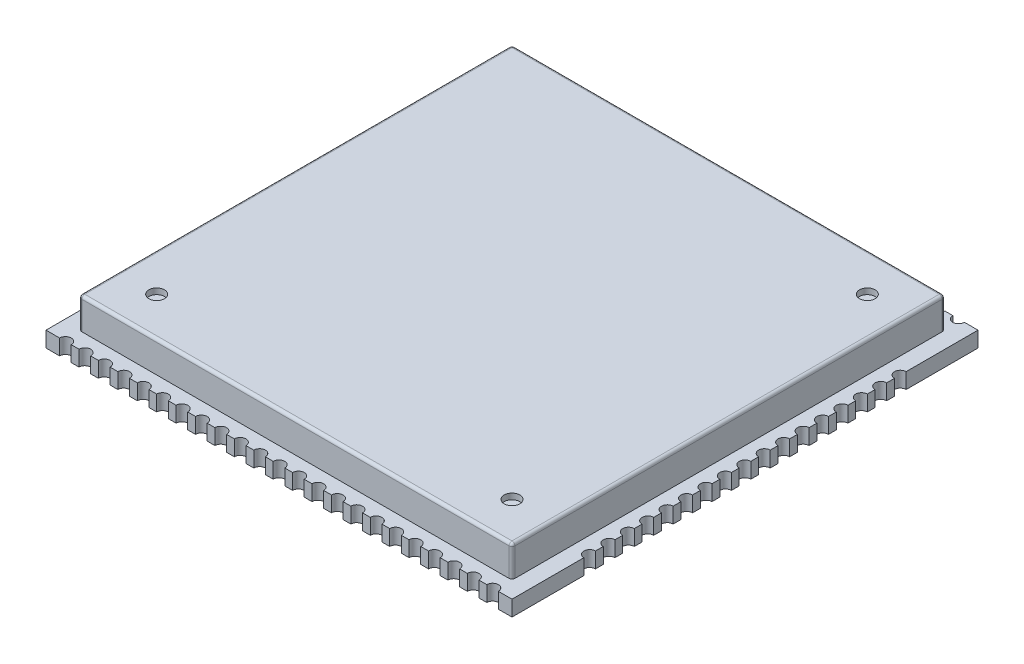
from build123d import *

# Parameters (mm, degrees)
SKETCH1_W               = 24
SKETCH1_H               = 24
PCB_BASE_DEPTH          = 0.8
SHIELD_START            = 0.8
SKETCH2_W               = 22.3
SKETCH2_H               = 22.3
SHIELD_DEPTH            = 1.6
SHIELD_SHELLING_T       = -0.3
HOLES_START             = 2.1
SKETCH4_R               = 0.4
HOLES_IN_SHIELD_DEPTH   = 0.3
CUT_EXTRUDE1_DEPTH      = 18.139428229
CUT_EXTRUDE1_DEPTH_BACK = 18.139428229
FILLET1_R               = 0.15


with BuildPart() as part:
    # Sketch1 → PCB BASE (new body)
    with BuildSketch(Plane(origin=(0, 0, 0), x_dir=(1, 0, 0), z_dir=(0, 1, 0))):
        Rectangle(SKETCH1_W, SKETCH1_H)
    extrude(amount=PCB_BASE_DEPTH)

    # Sketch3 → Cut-Extrude1 (cut, two sides: drawn at the far end of the back side and taken through both)
    with BuildSketch(Plane(origin=(0, 0, 0), x_dir=(1, 0, 0), z_dir=(0, 1, 0)).offset(-CUT_EXTRUDE1_DEPTH_BACK)):
        with BuildLine():
            Line((-12, -7.7), (-12, -8.3))
            ThreePointArc((-12, -8.3), (-11.7, -8), (-12, -7.7))
        make_face()
        with BuildLine():
            Line((-10.3, -12), (-9.7, -12))
            ThreePointArc((-9.7, -12), (-10, -11.7), (-10.3, -12))
        make_face()
        with BuildLine():
            Line((-9.3, -12), (-8.7, -12))
            ThreePointArc((-8.7, -12), (-9, -11.7), (-9.3, -12))
        make_face()
        with BuildLine():
            Line((-8.3, -12), (-7.7, -12))
            ThreePointArc((-7.7, -12), (-8, -11.7), (-8.3, -12))
        make_face()
        with BuildLine():
            Line((-7.3, -12), (-6.7, -12))
            ThreePointArc((-6.7, -12), (-7, -11.7), (-7.3, -12))
        make_face()
        with BuildLine():
            Line((-6.3, -12), (-5.7, -12))
            ThreePointArc((-5.7, -12), (-6, -11.7), (-6.3, -12))
        make_face()
        with BuildLine():
            Line((-5.3, -12), (-4.7, -12))
            ThreePointArc((-4.7, -12), (-5, -11.7), (-5.3, -12))
        make_face()
        with BuildLine():
            Line((-4.3, -12), (-3.7, -12))
            ThreePointArc((-3.7, -12), (-4, -11.7), (-4.3, -12))
        make_face()
        with BuildLine():
            Line((-3.3, -12), (-2.7, -12))
            ThreePointArc((-2.7, -12), (-3, -11.7), (-3.3, -12))
        make_face()
        with BuildLine():
            Line((-2.3, -12), (-1.7, -12))
            ThreePointArc((-1.7, -12), (-2, -11.7), (-2.3, -12))
        make_face()
        with BuildLine():
            Line((-1.3, -12), (-0.7, -12))
            ThreePointArc((-0.7, -12), (-1, -11.7), (-1.3, -12))
        make_face()
        with BuildLine():
            Line((-0.3, -12), (0.3, -12))
            ThreePointArc((0.3, -12), (0, -11.7), (-0.3, -12))
        make_face()
        with BuildLine():
            Line((0.7, -12), (1.3, -12))
            ThreePointArc((1.3, -12), (1, -11.7), (0.7, -12))
        make_face()
        with BuildLine():
            Line((1.7, -12), (2.3, -12))
            ThreePointArc((2.3, -12), (2, -11.7), (1.7, -12))
        make_face()
        with BuildLine():
            Line((2.7, -12), (3.3, -12))
            ThreePointArc((3.3, -12), (3, -11.7), (2.7, -12))
        make_face()
        with BuildLine():
            Line((3.7, -12), (4.3, -12))
            ThreePointArc((4.3, -12), (4, -11.7), (3.7, -12))
        make_face()
        with BuildLine():
            Line((4.7, -12), (5.3, -12))
            ThreePointArc((5.3, -12), (5, -11.7), (4.7, -12))
        make_face()
        with BuildLine():
            Line((5.7, -12), (6.3, -12))
            ThreePointArc((6.3, -12), (6, -11.7), (5.7, -12))
        make_face()
        with BuildLine():
            Line((6.7, -12), (7.3, -12))
            ThreePointArc((7.3, -12), (7, -11.7), (6.7, -12))
        make_face()
        with BuildLine():
            Line((7.7, -12), (8.3, -12))
            ThreePointArc((8.3, -12), (8, -11.7), (7.7, -12))
        make_face()
        with BuildLine():
            Line((8.7, -12), (9.3, -12))
            ThreePointArc((9.3, -12), (9, -11.7), (8.7, -12))
        make_face()
        with BuildLine():
            Line((9.7, -12), (10.3, -12))
            ThreePointArc((10.3, -12), (10, -11.7), (9.7, -12))
        make_face()
        with BuildLine():
            Line((10.7, -12), (11.3, -12))
            ThreePointArc((11.3, -12), (11, -11.7), (10.7, -12))
        make_face()
        with BuildLine():
            Line((-12, -6.7), (-12, -7.3))
            ThreePointArc((-12, -7.3), (-11.7, -7), (-12, -6.7))
        make_face()
        with BuildLine():
            Line((-11.3, -12), (-10.7, -12))
            ThreePointArc((-10.7, -12), (-11, -11.7), (-11.3, -12))
        make_face()
        with BuildLine():
            Line((-12, -5.7), (-12, -6.3))
            ThreePointArc((-12, -6.3), (-11.7, -6), (-12, -5.7))
        make_face()
        with BuildLine():
            Line((-12, -4.7), (-12, -5.3))
            ThreePointArc((-12, -5.3), (-11.7, -5), (-12, -4.7))
        make_face()
        with BuildLine():
            Line((-12, -3.7), (-12, -4.3))
            ThreePointArc((-12, -4.3), (-11.7, -4), (-12, -3.7))
        make_face()
        with BuildLine():
            Line((-12, -2.7), (-12, -3.3))
            ThreePointArc((-12, -3.3), (-11.7, -3), (-12, -2.7))
        make_face()
        with BuildLine():
            Line((-12, -1.7), (-12, -2.3))
            ThreePointArc((-12, -2.3), (-11.7, -2), (-12, -1.7))
        make_face()
        with BuildLine():
            Line((-12, -0.7), (-12, -1.3))
            ThreePointArc((-12, -1.3), (-11.7, -1), (-12, -0.7))
        make_face()
        with BuildLine():
            Line((-12, 0.3), (-12, -0.3))
            ThreePointArc((-12, -0.3), (-11.7, 0), (-12, 0.3))
        make_face()
        with BuildLine():
            Line((-12, 1.3), (-12, 0.7))
            ThreePointArc((-12, 0.7), (-11.7, 1), (-12, 1.3))
        make_face()
        with BuildLine():
            Line((-12, 2.3), (-12, 1.7))
            ThreePointArc((-12, 1.7), (-11.7, 2), (-12, 2.3))
        make_face()
        with BuildLine():
            Line((-12, 3.3), (-12, 2.7))
            ThreePointArc((-12, 2.7), (-11.7, 3), (-12, 3.3))
        make_face()
        with BuildLine():
            Line((-12, 4.3), (-12, 3.7))
            ThreePointArc((-12, 3.7), (-11.7, 4), (-12, 4.3))
        make_face()
        with BuildLine():
            Line((-12, 5.3), (-12, 4.7))
            ThreePointArc((-12, 4.7), (-11.7, 5), (-12, 5.3))
        make_face()
        with BuildLine():
            Line((-12, 6.3), (-12, 5.7))
            ThreePointArc((-12, 5.7), (-11.7, 6), (-12, 6.3))
        make_face()
        with BuildLine():
            Line((-12, 7.3), (-12, 6.7))
            ThreePointArc((-12, 6.7), (-11.7, 7), (-12, 7.3))
        make_face()
        with BuildLine():
            Line((-12, 8.3), (-12, 7.7))
            ThreePointArc((-12, 7.7), (-11.7, 8), (-12, 8.3))
        make_face()
        with BuildLine():
            Line((-11.3, 12), (-10.7, 12))
            ThreePointArc((-10.7, 12), (-11, 11.7), (-11.3, 12))
        make_face()
        with BuildLine():
            Line((10.7, 12), (11.3, 12))
            ThreePointArc((11.3, 12), (11, 11.7), (10.7, 12))
        make_face()
        with BuildLine():
            Line((9.7, 12), (10.3, 12))
            ThreePointArc((10.3, 12), (10, 11.7), (9.7, 12))
        make_face()
        with BuildLine():
            Line((8.7, 12), (9.3, 12))
            ThreePointArc((9.3, 12), (9, 11.7), (8.7, 12))
        make_face()
        with BuildLine():
            Line((7.7, 12), (8.3, 12))
            ThreePointArc((8.3, 12), (8, 11.7), (7.7, 12))
        make_face()
        with BuildLine():
            Line((6.7, 12), (7.3, 12))
            ThreePointArc((7.3, 12), (7, 11.7), (6.7, 12))
        make_face()
        with BuildLine():
            Line((5.7, 12), (6.3, 12))
            ThreePointArc((6.3, 12), (6, 11.7), (5.7, 12))
        make_face()
        with BuildLine():
            Line((4.7, 12), (5.3, 12))
            ThreePointArc((5.3, 12), (5, 11.7), (4.7, 12))
        make_face()
        with BuildLine():
            Line((3.7, 12), (4.3, 12))
            ThreePointArc((4.3, 12), (4, 11.7), (3.7, 12))
        make_face()
        with BuildLine():
            Line((2.7, 12), (3.3, 12))
            ThreePointArc((3.3, 12), (3, 11.7), (2.7, 12))
        make_face()
        with BuildLine():
            Line((1.7, 12), (2.3, 12))
            ThreePointArc((2.3, 12), (2, 11.7), (1.7, 12))
        make_face()
        with BuildLine():
            Line((0.7, 12), (1.3, 12))
            ThreePointArc((1.3, 12), (1, 11.7), (0.7, 12))
        make_face()
        with BuildLine():
            Line((-0.3, 12), (0.3, 12))
            ThreePointArc((0.3, 12), (0, 11.7), (-0.3, 12))
        make_face()
        with BuildLine():
            Line((-1.3, 12), (-0.7, 12))
            ThreePointArc((-0.7, 12), (-1, 11.7), (-1.3, 12))
        make_face()
        with BuildLine():
            Line((-2.3, 12), (-1.7, 12))
            ThreePointArc((-1.7, 12), (-2, 11.7), (-2.3, 12))
        make_face()
        with BuildLine():
            Line((-3.3, 12), (-2.7, 12))
            ThreePointArc((-2.7, 12), (-3, 11.7), (-3.3, 12))
        make_face()
        with BuildLine():
            Line((-4.3, 12), (-3.7, 12))
            ThreePointArc((-3.7, 12), (-4, 11.7), (-4.3, 12))
        make_face()
        with BuildLine():
            Line((-5.3, 12), (-4.7, 12))
            ThreePointArc((-4.7, 12), (-5, 11.7), (-5.3, 12))
        make_face()
        with BuildLine():
            Line((-6.3, 12), (-5.7, 12))
            ThreePointArc((-5.7, 12), (-6, 11.7), (-6.3, 12))
        make_face()
        with BuildLine():
            Line((-7.3, 12), (-6.7, 12))
            ThreePointArc((-6.7, 12), (-7, 11.7), (-7.3, 12))
        make_face()
        with BuildLine():
            Line((-8.3, 12), (-7.7, 12))
            ThreePointArc((-7.7, 12), (-8, 11.7), (-8.3, 12))
        make_face()
        with BuildLine():
            Line((-9.3, 12), (-8.7, 12))
            ThreePointArc((-8.7, 12), (-9, 11.7), (-9.3, 12))
        make_face()
        with BuildLine():
            Line((-10.3, 12), (-9.7, 12))
            ThreePointArc((-9.7, 12), (-10, 11.7), (-10.3, 12))
        make_face()
        with BuildLine():
            Line((12, 8.3), (12, 7.7))
            ThreePointArc((12, 7.7), (11.7, 8), (12, 8.3))
        make_face()
        with BuildLine():
            Line((12, 7.3), (12, 6.7))
            ThreePointArc((12, 6.7), (11.7, 7), (12, 7.3))
        make_face()
        with BuildLine():
            Line((12, 6.3), (12, 5.7))
            ThreePointArc((12, 5.7), (11.7, 6), (12, 6.3))
        make_face()
        with BuildLine():
            Line((12, 5.3), (12, 4.7))
            ThreePointArc((12, 4.7), (11.7, 5), (12, 5.3))
        make_face()
        with BuildLine():
            Line((12, 4.3), (12, 3.7))
            ThreePointArc((12, 3.7), (11.7, 4), (12, 4.3))
        make_face()
        with BuildLine():
            Line((12, 3.3), (12, 2.7))
            ThreePointArc((12, 2.7), (11.7, 3), (12, 3.3))
        make_face()
        with BuildLine():
            Line((12, 2.3), (12, 1.7))
            ThreePointArc((12, 1.7), (11.7, 2), (12, 2.3))
        make_face()
        with BuildLine():
            Line((12, 1.3), (12, 0.7))
            ThreePointArc((12, 0.7), (11.7, 1), (12, 1.3))
        make_face()
        with BuildLine():
            Line((12, 0.3), (12, -0.3))
            ThreePointArc((12, -0.3), (11.7, 0), (12, 0.3))
        make_face()
        with BuildLine():
            Line((12, -0.7), (12, -1.3))
            ThreePointArc((12, -1.3), (11.7, -1), (12, -0.7))
        make_face()
        with BuildLine():
            Line((12, -1.7), (12, -2.3))
            ThreePointArc((12, -2.3), (11.7, -2), (12, -1.7))
        make_face()
        with BuildLine():
            Line((12, -2.7), (12, -3.3))
            ThreePointArc((12, -3.3), (11.7, -3), (12, -2.7))
        make_face()
        with BuildLine():
            Line((12, -3.7), (12, -4.3))
            ThreePointArc((12, -4.3), (11.7, -4), (12, -3.7))
        make_face()
        with BuildLine():
            Line((12, -4.7), (12, -5.3))
            ThreePointArc((12, -5.3), (11.7, -5), (12, -4.7))
        make_face()
        with BuildLine():
            Line((12, -5.7), (12, -6.3))
            ThreePointArc((12, -6.3), (11.7, -6), (12, -5.7))
        make_face()
        with BuildLine():
            Line((12, -6.7), (12, -7.3))
            ThreePointArc((12, -7.3), (11.7, -7), (12, -6.7))
        make_face()
        with BuildLine():
            Line((12, -7.7), (12, -8.3))
            ThreePointArc((12, -8.3), (11.7, -8), (12, -7.7))
        make_face()
    extrude(amount=CUT_EXTRUDE1_DEPTH + CUT_EXTRUDE1_DEPTH_BACK, mode=Mode.SUBTRACT)


with BuildPart() as body_2:
    # Sketch2 → SHIELD (new body)
    with BuildSketch(Plane(origin=(0, 0, 0), x_dir=(1, 0, 0), z_dir=(0, 1, 0)).offset(SHIELD_START)):
        Rectangle(SKETCH2_W, SKETCH2_H)
    extrude(amount=SHIELD_DEPTH)

    # Shield shelling
    shield_shelling_openings = [body_2.faces().sort_by_distance(p)[0] for p in [
        (0, 0.8, 0),
    ]]
    offset(amount=SHIELD_SHELLING_T, openings=shield_shelling_openings, kind=Kind.INTERSECTION)

    # Sketch4 → Holes in shield (cut)
    with BuildSketch(Plane(origin=(0, 0, 0), x_dir=(1, 0, 0), z_dir=(0, 1, 0)).offset(HOLES_START)):
        with Locations(Location((-9.15, -9.15, 0), (0, 0, 270))):
            Circle(SKETCH4_R)
        with Locations(Location((9.15, 9.15, 0), (0, 0, 270))):
            Circle(SKETCH4_R)
        with Locations(Location((9.15, -9.15, 0), (0, 0, 270))):
            Circle(SKETCH4_R)
    extrude(amount=HOLES_IN_SHIELD_DEPTH, mode=Mode.SUBTRACT)

    # Fillet1
    fillet1_edges = [body_2.edges().sort_by_distance(p)[0] for p in [
        (-11.15, 2.4, 0),
        (0, 2.4, 11.15),
        (11.15, 2.4, 0),
        (0, 2.4, -11.15),
        (11.15, 1.6, 11.15),
        (-11.15, 1.6, 11.15),
        (-11.15, 1.6, -11.15),
        (11.15, 1.6, -11.15),
    ]]
    fillet(fillet1_edges, radius=FILLET1_R)


solid = Compound([part.part, body_2.part])
